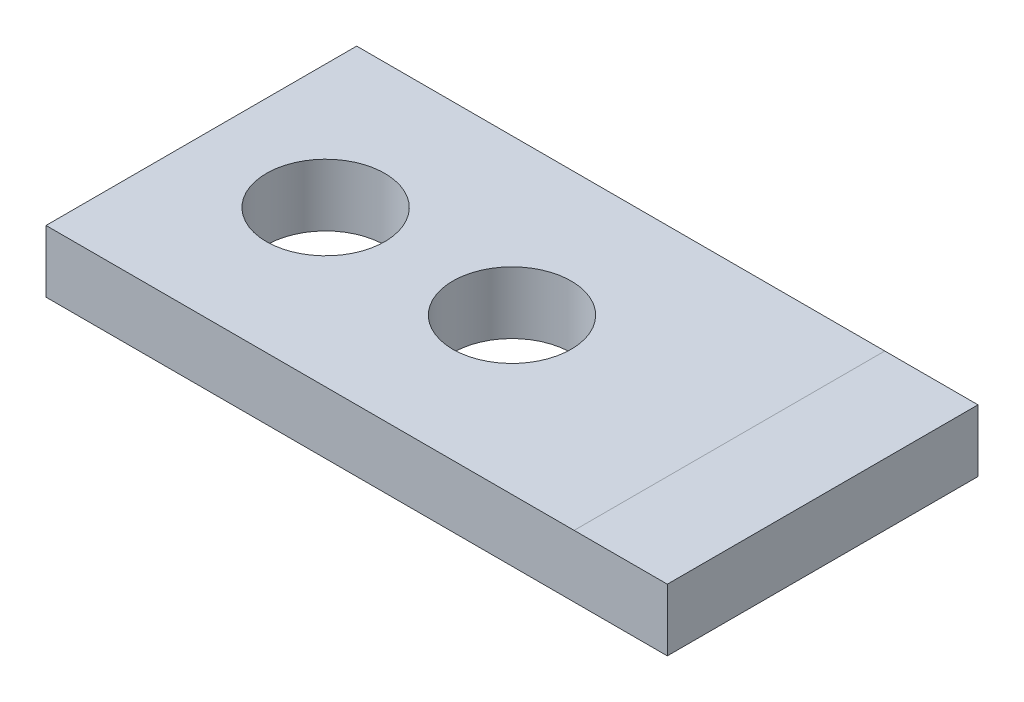
from build123d import *

# Parameters (mm, degrees)
SKETCH1_W           = 100
SKETCH1_H           = 50
SKETCH1_R           = 9.525
BOSS_EXTRUDE1_DEPTH = 10


with BuildPart() as part:
    # Sketch1 → Boss-Extrude1 (new body)
    with BuildSketch(Plane(origin=(0, 0, 0), x_dir=(1, 0, 0), z_dir=(0, 1, 0))):
        with Locations((50, 25)):
            Rectangle(SKETCH1_W, SKETCH1_H)
        with Locations(Location((20, 25, 0), (0, 0, 270))):
            Circle(SKETCH1_R, mode=Mode.SUBTRACT)
        with Locations(Location((50, 25, 0), (0, 0, 270))):
            Circle(SKETCH1_R, mode=Mode.SUBTRACT)
    extrude(amount=BOSS_EXTRUDE1_DEPTH)


solid = part.part
